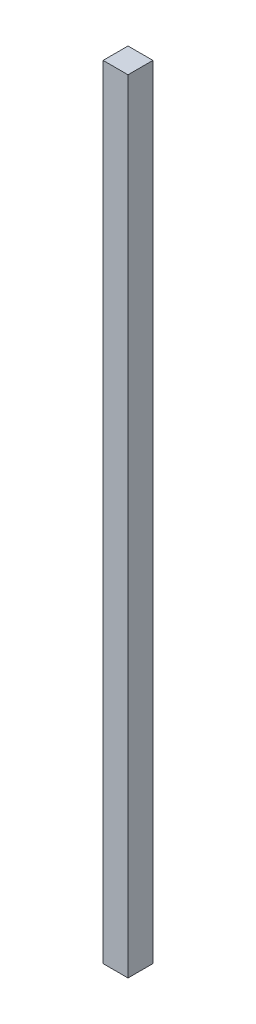
from build123d import *

# Parameters (mm, degrees)
SKETCH1_W           = 25.4
SKETCH1_H           = 25.4
BOSS_EXTRUDE1_DEPTH = 797.56


with BuildPart() as part:
    # Sketch1 → Boss-Extrude1 (new body)
    with BuildSketch(Plane(origin=(0, 0, 0), x_dir=(1, 0, 0), z_dir=(0, 1, 0))):
        with Locations((6.755319149, 2.026595745)):
            Rectangle(SKETCH1_W, SKETCH1_H)
    extrude(amount=BOSS_EXTRUDE1_DEPTH)


solid = part.part
